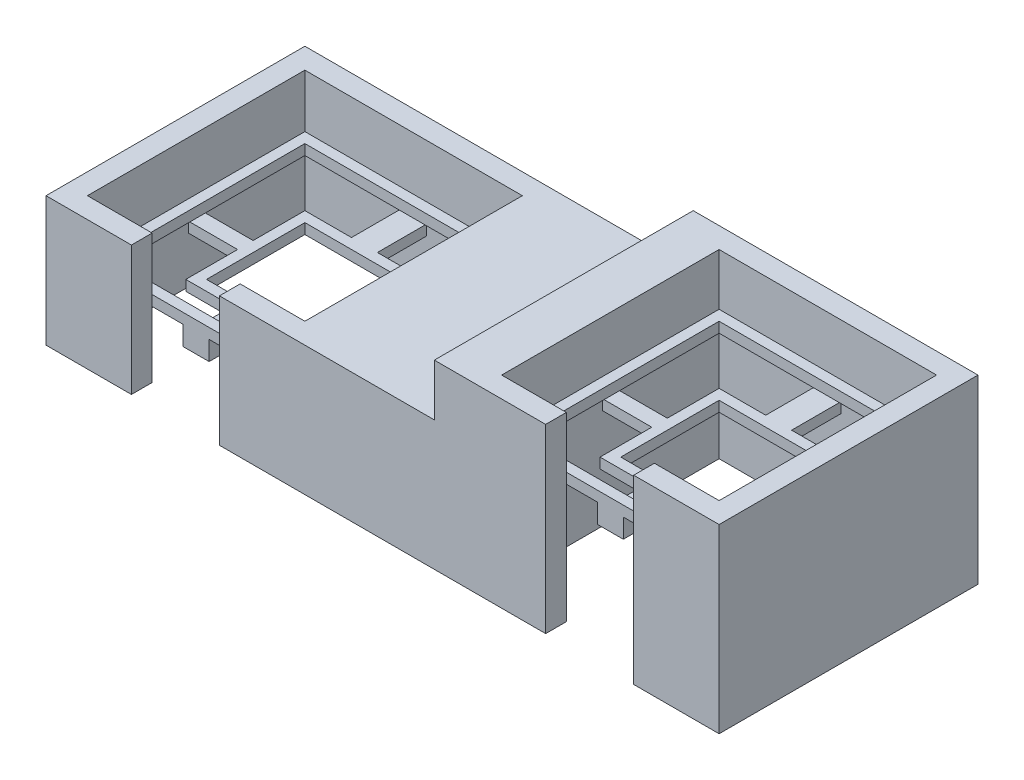
from build123d import *

# Parameters (mm, degrees)
SKETCH1_W               = 42
SKETCH1_H               = 42
BOSS_EXTRUDE4_DEPTH     = 10
CUT_EXTRUDE3_DEPTH      = 117.726175299
CUT_EXTRUDE3_DEPTH_BACK = 4
SKETCH5_W               = 17
SKETCH5_H               = 10
BOSS_EXTRUDE5_DEPTH     = 10
CUT_EXTRUDE5_DEPTH      = 119.004237212
CUT_EXTRUDE5_DEPTH_BACK = 119.004237212
SKETCH8_W               = 10
SKETCH8_H               = 10
BOSS_EXTRUDE6_DEPTH     = 15
BOSS_EXTRUDE7_START     = -10.28
SKETCH10_W              = 42
SKETCH10_H              = 42
SKETCH10_W_2            = 38
SKETCH10_H_2            = 38
BOSS_EXTRUDE7_DEPTH     = 2
BOSS_EXTRUDE8_START     = -10
SKETCH11_W              = 42
SKETCH11_H              = 42
SKETCH11_W_2            = 38
SKETCH11_H_2            = 38
BOSS_EXTRUDE8_DEPTH     = 2
SKETCH12_W              = 5
SKETCH12_H              = 7.5
SKETCH12_H_2            = 6
SKETCH12_W_2            = 23
SKETCH12_H_3            = 23
SKETCH12_W_3            = 19
SKETCH12_H_4            = 19
SKETCH12_H_5            = 2
SKETCH12_W_4            = 7.5
SKETCH12_H_6            = 3
SKETCH12_W_5            = 2
BOSS_EXTRUDE9_DEPTH     = 2
SKETCH15_W              = 5
SKETCH15_H              = 2
BOSS_EXTRUDE12_DEPTH    = 1.72
SKETCH16_W              = 3
SKETCH16_H              = 2
BOSS_EXTRUDE13_DEPTH    = 2
SKETCH17_W              = 3
SKETCH17_H              = 2
BOSS_EXTRUDE14_DEPTH    = 2
SKETCH19_W              = 19
SKETCH19_H              = 8
BOSS_EXTRUDE15_DEPTH    = 2
SKETCH20_W              = 19
SKETCH20_H              = 19
CUT_EXTRUDE6_DEPTH      = 2
SKETCH21_W              = 5
SKETCH21_H              = 2
BOSS_EXTRUDE16_DEPTH    = 2


with BuildPart() as part:
    # Sketch1 → Boss-Extrude4 (new body)
    with BuildSketch(Plane(origin=(0, 0, 0), x_dir=(1, 0, 0), z_dir=(0, 1, 0))):
        Polygon((-25, -25), (25, -25), (55, -25), (105, -25), (105, 25), (55, 25), (25, 25), (-25, 25), align=None)
        with Locations((80, 0)):
            Rectangle(SKETCH1_W, SKETCH1_H, mode=Mode.SUBTRACT)
        Rectangle(SKETCH1_W, SKETCH1_H, mode=Mode.SUBTRACT)
    extrude(amount=BOSS_EXTRUDE4_DEPTH)

    # Sketch5 → Cut-Extrude3 (cut, two sides: drawn at the far end of the back side and taken through both)
    with BuildSketch(Plane.XY.offset(25).offset(-CUT_EXTRUDE3_DEPTH_BACK)):
        with Locations((0, 5)):
            Rectangle(SKETCH5_W, SKETCH5_H)
        with Locations((80, 5)):
            Rectangle(SKETCH5_W, SKETCH5_H)
    extrude(amount=CUT_EXTRUDE3_DEPTH + CUT_EXTRUDE3_DEPTH_BACK, mode=Mode.SUBTRACT)

    # Sketch6 → Boss-Extrude5 (add)
    with BuildSketch(Plane(origin=(0, 10, 0), x_dir=(1, 0, 0), z_dir=(0, 1, 0))):
        Polygon((105, 25), (40, 25), (40, -25), (71.5, -25), (71.5, -21), (59, -21), (59, 21), (101, 21), (101, -21), (88.5, -21), (88.5, -25), (105, -25), align=None)
    extrude(amount=BOSS_EXTRUDE5_DEPTH)

    # Sketch8 → Cut-Extrude5 (cut, two sides: drawn at the far end of the back side and taken through both)
    with BuildSketch(Plane.XY.offset(25).offset(-CUT_EXTRUDE5_DEPTH_BACK)):
        with Locations((45, 15)):
            Rectangle(SKETCH8_W, SKETCH8_H)
    extrude(amount=CUT_EXTRUDE5_DEPTH + CUT_EXTRUDE5_DEPTH_BACK, mode=Mode.SUBTRACT)

    # Sketch9 → Boss-Extrude6 (add)
    with BuildSketch(Plane.XZ):
        Polygon((-21, 21), (-8.5, 21), (-8.5, 25), (-25, 25), (-25, -25), (105, -25), (105, 25), (88.5, 25), (88.5, 21), (101, 21), (101, -21), (59, -21), (59, 21), (71.5, 21), (71.5, 25), (8.5, 25), (8.5, 21), (21, 21), (21, -21), (-21, -21), align=None)
    extrude(amount=BOSS_EXTRUDE6_DEPTH)

    # Sketch10 → Boss-Extrude7 (add)
    with BuildSketch(Plane(origin=(0, 10, 0), x_dir=(1, 0, 0), z_dir=(0, 1, 0)).offset(BOSS_EXTRUDE7_START)):
        Rectangle(SKETCH10_W, SKETCH10_H)
        Rectangle(SKETCH10_W_2, SKETCH10_H_2, mode=Mode.SUBTRACT)
    extrude(amount=-BOSS_EXTRUDE7_DEPTH)

    # Sketch11 → Boss-Extrude8 (add)
    with BuildSketch(Plane(origin=(0, 20, 0), x_dir=(1, 0, 0), z_dir=(0, 1, 0)).offset(BOSS_EXTRUDE8_START)):
        with Locations((80, 0)):
            Rectangle(SKETCH11_W, SKETCH11_H)
        with Locations((80, 0)):
            Rectangle(SKETCH11_W_2, SKETCH11_H_2, mode=Mode.SUBTRACT)
    extrude(amount=-BOSS_EXTRUDE8_DEPTH)

    # Sketch12 → Boss-Extrude9 (add)
    # profile 1 of 10: a face of its own
    with BuildSketch(Plane(origin=(0, -4, 0), x_dir=(1, 0, 0), z_dir=(0, 1, 0))):
        with Locations((0, 15.25)):
            Rectangle(SKETCH12_W, SKETCH12_H)
    # profile 2 of 10: a face of its own
    with BuildSketch(Plane(origin=(0, -4, 0), x_dir=(1, 0, 0), z_dir=(0, 1, 0))):
        with Locations((0, 22)):
            Rectangle(SKETCH12_W, SKETCH12_H_2)
    # profile 3 of 10: a face of its own
    with BuildSketch(Plane(origin=(0, -4, 0), x_dir=(1, 0, 0), z_dir=(0, 1, 0))):
        Rectangle(SKETCH12_W_2, SKETCH12_H_3)
        Rectangle(SKETCH12_W_3, SKETCH12_H_4, mode=Mode.SUBTRACT)
    # profile 4 of 10: a face of its own
    with BuildSketch(Plane(origin=(0, -4, 0), x_dir=(1, 0, 0), z_dir=(0, 1, 0))):
        with Locations((0, -15.25)):
            Rectangle(SKETCH12_W, SKETCH12_H)
    # profile 5 of 10: a face of its own
    with BuildSketch(Plane(origin=(0, -4, 0), x_dir=(1, 0, 0), z_dir=(0, 1, 0))):
        with Locations((0, -20)):
            Rectangle(SKETCH12_W, SKETCH12_H_5)
    # profile 6 of 10: a face of its own
    with BuildSketch(Plane(origin=(0, -4, 0), x_dir=(1, 0, 0), z_dir=(0, 1, 0))):
        with Locations((-15.25, 0)):
            Rectangle(SKETCH12_W_4, SKETCH12_H_6)
    # profile 7 of 10: a face of its own
    with BuildSketch(Plane(origin=(0, -4, 0), x_dir=(1, 0, 0), z_dir=(0, 1, 0))):
        with Locations((-10.5, 0)):
            Rectangle(SKETCH12_W_5, SKETCH12_H_6)
    # profile 8 of 10: a face of its own
    with BuildSketch(Plane(origin=(0, -4, 0), x_dir=(1, 0, 0), z_dir=(0, 1, 0))):
        Polygon((-9.5, -1.5), (-11.5, -1.5), (-11.5, -11.5), (-2.5, -11.5), (2.5, -11.5), (11.5, -11.5), (11.5, -1.5), (9.5, -1.5), (9.5, -9.5), (2.5, -9.5), (-2.5, -9.5), (-9.5, -9.5), align=None)
    # profile 9 of 10: a face of its own
    with BuildSketch(Plane(origin=(0, -4, 0), x_dir=(1, 0, 0), z_dir=(0, 1, 0))):
        with Locations((10.5, 0)):
            Rectangle(SKETCH12_W_5, SKETCH12_H_6)
    # profile 10 of 10: a face of its own
    with BuildSketch(Plane(origin=(0, -4, 0), x_dir=(1, 0, 0), z_dir=(0, 1, 0))):
        with Locations((15.25, 0)):
            Rectangle(SKETCH12_W_4, SKETCH12_H_6)
    extrude(amount=-BOSS_EXTRUDE9_DEPTH)

    # Sketch15 → Boss-Extrude12 (add)
    with BuildSketch(Plane(origin=(0, -4, 0), x_dir=(1, 0, 0), z_dir=(0, 1, 0))):
        with Locations((0, -20)):
            Rectangle(SKETCH15_W, SKETCH15_H)
    extrude(amount=BOSS_EXTRUDE12_DEPTH)

    # Sketch16 → Boss-Extrude13 (add)
    with BuildSketch(Plane.ZY.offset(19)):
        with Locations((0, -5)):
            Rectangle(SKETCH16_W, SKETCH16_H)
    extrude(amount=BOSS_EXTRUDE13_DEPTH)

    # Sketch17 → Boss-Extrude14 (add)
    with BuildSketch(Plane(origin=(19, 0, 0), x_dir=(0, 0, -1), z_dir=(1, 0, 0))):
        with Locations((0, -5)):
            Rectangle(SKETCH17_W, SKETCH17_H)
    extrude(amount=BOSS_EXTRUDE14_DEPTH)

    # Sketch19 → Boss-Extrude15 (add)
    with BuildSketch(Plane(origin=(0, 6.28, 0), x_dir=(1, 0, 0), z_dir=(0, 1, 0))):
        Polygon((91.5, 11.5), (82.5, 11.5), (82.5, 21), (77.5, 21), (77.5, 11.5), (68.5, 11.5), (68.5, 1.5), (59, 1.5), (59, -1.5), (68.5, -1.5), (68.5, -11.5), (77.5, -11.5), (77.5, -21), (82.5, -21), (82.5, -11.5), (91.5, -11.5), (91.5, -1.5), (101, -1.5), (101, 1.5), (91.5, 1.5), align=None)
        with Locations((80, -5.5)):
            Rectangle(SKETCH19_W, SKETCH19_H, mode=Mode.SUBTRACT)
        with Locations((80, 5.5)):
            Rectangle(SKETCH19_W, SKETCH19_H, mode=Mode.SUBTRACT)
    extrude(amount=-BOSS_EXTRUDE15_DEPTH)

    # Sketch20 → Cut-Extrude6 (cut)
    with BuildSketch(Plane(origin=(0, 6.28, 0), x_dir=(1, 0, 0), z_dir=(0, 1, 0))):
        with Locations((80, 0)):
            Rectangle(SKETCH20_W, SKETCH20_H)
    extrude(amount=-CUT_EXTRUDE6_DEPTH, mode=Mode.SUBTRACT)

    # Sketch21 → Boss-Extrude16 (add)
    with BuildSketch(Plane(origin=(0, 6.28, 0), x_dir=(1, 0, 0), z_dir=(0, 1, 0))):
        with Locations((80, -20)):
            Rectangle(SKETCH21_W, SKETCH21_H)
    extrude(amount=BOSS_EXTRUDE16_DEPTH)


solid = part.part
